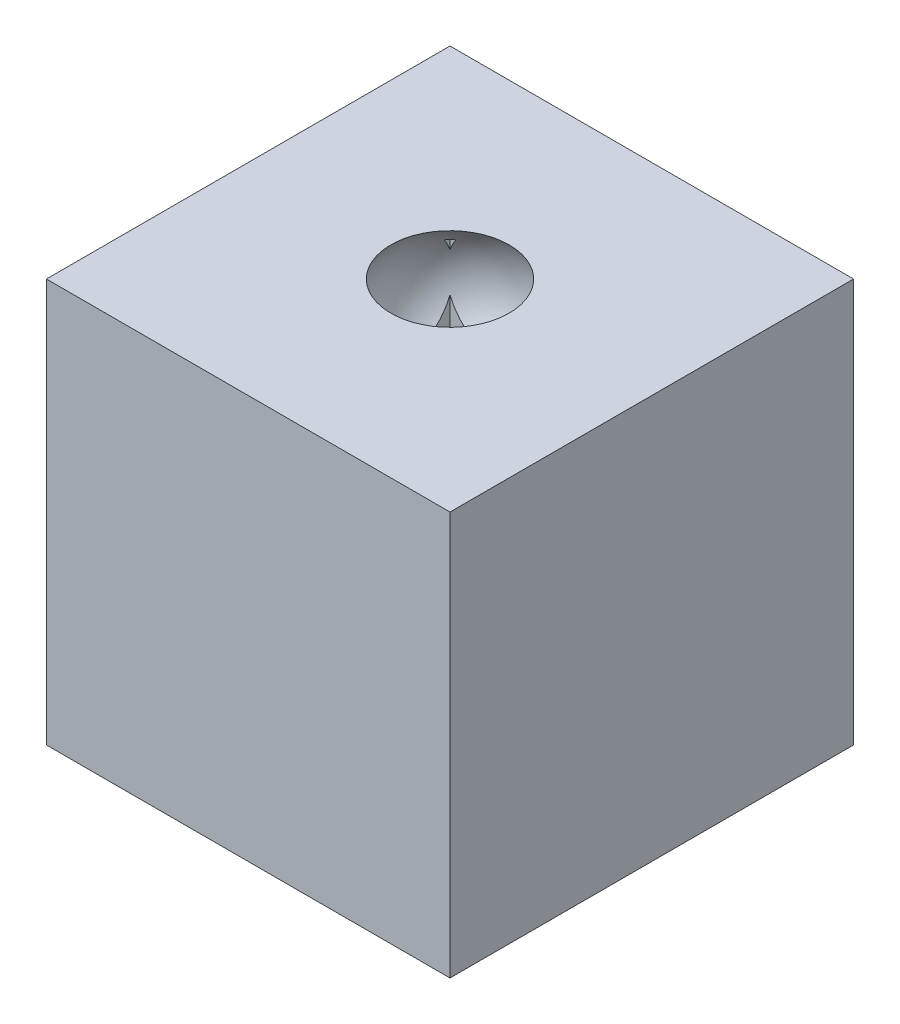
from build123d import *

# Parameters (mm, degrees)
SKETCH1_W                  = 76.2
SKETCH1_H                  = 76.2
MAIN_BODY_DEPTH            = 76.2
SKETCH6_W                  = 50.8
SKETCH6_H                  = 33.02
CAMERA_BASE_DEPTH          = 2.54
SHELL_T                    = -2.54
SKETCH13_R                 = 1.905
SCREW_MOUNTS_DEPTH         = 2.54
F_4_40_TAPPED_HOLE1_REACH  = 95.326
F_4_40_TAPPED_HOLE1_BORE_R = 1.1303
CHECK_OUT_THE_BOTTOM_REACH = 95.326
SKETCH16_W                 = 19.05
SKETCH16_H                 = 19.05


with BuildPart() as part:
    # Sketch1 → main body (new body)
    with BuildSketch(Plane(origin=(0, 0, 0), x_dir=(1, 0, 0), z_dir=(0, 1, 0))):
        Rectangle(SKETCH1_W, SKETCH1_H)
    extrude(amount=MAIN_BODY_DEPTH)

    # Sketch5 → trackball hole (revolve, cut)
    with BuildSketch(Plane.XY):
        with BuildLine():
            Line((0, 81.788), (0, 53.848))
            ThreePointArc((0, 53.848), (13.97, 67.818), (0, 81.788))
        make_face()
    revolve(axis=Axis((0, -906.782, 0), (0, 1, 0)), mode=Mode.SUBTRACT)

    # Sketch6 → camera base (add)
    with BuildSketch(Plane.XZ):
        Rectangle(SKETCH6_W, SKETCH6_H)
    extrude(amount=CAMERA_BASE_DEPTH)

    # shell
    shell_openings = [part.faces().sort_by_distance(p)[0] for p in [
        (0, -2.54, 0),
    ]]
    offset(amount=SHELL_T, openings=shell_openings, kind=Kind.INTERSECTION)

    # Sketch13 → screw mounts (add)
    with BuildSketch(Plane.XZ):
        with Locations((-25.4, 0)):
            Circle(SKETCH13_R)
        with Locations((25.4, 0)):
            Circle(SKETCH13_R)
    extrude(amount=SCREW_MOUNTS_DEPTH)

    # #4-40 Tapped Hole1 bore → #4-40 Tapped Hole1 (cut, up to next)
    with BuildSketch(Plane(origin=(0, 0, 0), x_dir=(-1, 0, 0), z_dir=(0, -1, 0)), mode=Mode.PRIVATE) as f_4_40_tapped_hole1_sk1:
        with Locations((25.4, 0)):
            Circle(F_4_40_TAPPED_HOLE1_BORE_R)
    f_4_40_tapped_hole1_tool1 = extrude(f_4_40_tapped_hole1_sk1.sketch, amount=-F_4_40_TAPPED_HOLE1_REACH, mode=Mode.PRIVATE) & part.part
    # #4-40 Tapped Hole1 bore → #4-40 Tapped Hole1 (cut, up to next)
    with BuildSketch(Plane(origin=(0, 0, 0), x_dir=(-1, 0, 0), z_dir=(0, -1, 0)), mode=Mode.PRIVATE) as f_4_40_tapped_hole1_sk2:
        with Locations((-25.4, 0)):
            Circle(F_4_40_TAPPED_HOLE1_BORE_R)
    f_4_40_tapped_hole1_tool2 = extrude(f_4_40_tapped_hole1_sk2.sketch, amount=-F_4_40_TAPPED_HOLE1_REACH, mode=Mode.PRIVATE) & part.part
    add(f_4_40_tapped_hole1_tool1.solids().sort_by_distance((-25.4, 0, 0))[0], mode=Mode.SUBTRACT)
    add(f_4_40_tapped_hole1_tool2.solids().sort_by_distance((25.4, 0, 0))[0], mode=Mode.SUBTRACT)

    # check out the bottom: up to this face of the body (flat: up to its plane)
    check_out_the_bottom_end = Plane(part.part.faces().sort_by_distance((0, 73.66, -34.554211314))[0])
    # Sketch16 → check out the bottom (cut, up to the picked face)
    with BuildSketch(Plane(origin=(0, 0, 0), x_dir=(1, 0, 0), z_dir=(0, 1, 0)), mode=Mode.PRIVATE) as check_out_the_bottom_sk1:
        Rectangle(SKETCH16_W, SKETCH16_H)
    check_out_the_bottom_tool1 = split(extrude(check_out_the_bottom_sk1.sketch, amount=CHECK_OUT_THE_BOTTOM_REACH, mode=Mode.PRIVATE), bisect_by=check_out_the_bottom_end, keep=Keep.BOTH, mode=Mode.PRIVATE)
    add(check_out_the_bottom_tool1.solids().sort_by(Axis((0, 0, 0), (0, 1, 0)))[0], mode=Mode.SUBTRACT)


solid = part.part
